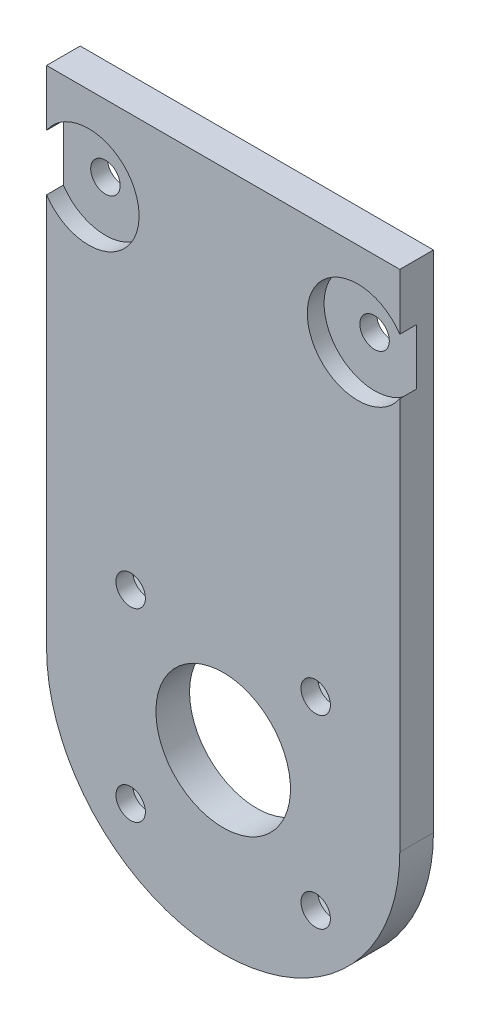
from build123d import *

# Parameters (mm, degrees)
BOSS_EXTRUDE1_DEPTH = 4
SKETCH2_R           = 6
CUT_EXTRUDE1_DEPTH  = 64.694583757
SKETCH3_R           = 8
CUT_EXTRUDE2_DEPTH  = 4
SKETCH4_R           = 1.75
CUT_EXTRUDE3_DEPTH  = 64.694583757
CUT_EXTRUDE4_DEPTH  = 2
SKETCH6_R           = 1.75
CUT_EXTRUDE5_DEPTH  = 64.694583757
SKETCH7_R           = 6
CUT_EXTRUDE6_DEPTH  = 2


with BuildPart() as part:
    # Sketch1 → Boss-Extrude1 (new body)
    with BuildSketch(Plane.XY):
        with BuildLine():
            Line((-21, 0), (-21, 60))
            Line((-21, 60), (21, 60))
            Line((21, 60), (21, 0))
            ThreePointArc((21, 0), (0, -21), (-21, 0))
        make_face()
    extrude(amount=BOSS_EXTRUDE1_DEPTH)

    # Sketch2 → Cut-Extrude1 (cut, through all)
    with BuildSketch(Plane(origin=(0, 0, 0), x_dir=(-1, 0, 0), z_dir=(0, 0, -1))):
        Circle(SKETCH2_R)
    extrude(amount=-CUT_EXTRUDE1_DEPTH, mode=Mode.SUBTRACT)

    # Sketch3 → Cut-Extrude2 (cut)
    with BuildSketch(Plane(origin=(0, 0, 0), x_dir=(-1, 0, 0), z_dir=(0, 0, -1))):
        Circle(SKETCH3_R)
    extrude(amount=-CUT_EXTRUDE2_DEPTH, mode=Mode.SUBTRACT)

    # Sketch4 → Cut-Extrude3 (cut, through all)
    with BuildSketch(Plane(origin=(0, 0, 0), x_dir=(-1, 0, 0), z_dir=(0, 0, -1))):
        with Locations((-11, -11)):
            Circle(SKETCH4_R)
        with Locations(Location((-11, 11, 0), (0, 0, 180))):
            Circle(SKETCH4_R)
        with Locations((11, 11)):
            Circle(SKETCH4_R)
        with Locations(Location((11, -11, 0), (0, 0, 180))):
            Circle(SKETCH4_R)
    extrude(amount=-CUT_EXTRUDE3_DEPTH, mode=Mode.SUBTRACT)

    # Sketch5 → Cut-Extrude4 (cut)
    with BuildSketch(Plane(origin=(0, 0, 0), x_dir=(-1, 0, 0), z_dir=(0, 0, -1))):
        Polygon((-11, -7.709103466), (-13.85, -9.354551733), (-13.85, -12.645448267), (-11, -14.290896534), (-8.15, -12.645448267), (-8.15, -9.354551733), align=None)
        Polygon((-8.15, 9.354551733), (-11, 7.709103466), (-13.85, 9.354551733), (-13.85, 12.645448267), (-11, 14.290896534), (-8.15, 12.645448267), align=None)
        Polygon((11, 7.709103466), (13.85, 9.354551733), (13.85, 12.645448267), (11, 14.290896534), (8.15, 12.645448267), (8.15, 9.354551733), align=None)
        Polygon((8.15, -9.354551733), (11, -7.709103466), (13.85, -9.354551733), (13.85, -12.645448267), (11, -14.290896534), (8.15, -12.645448267), align=None)
    extrude(amount=-CUT_EXTRUDE4_DEPTH, mode=Mode.SUBTRACT)

    # Sketch6 → Cut-Extrude5 (cut, through all)
    with BuildSketch(Plane(origin=(0, 0, 0), x_dir=(-1, 0, 0), z_dir=(0, 0, -1))):
        with Locations((-16, 50)):
            Circle(SKETCH6_R)
        with Locations(Location((16, 50, 0), (0, 0, 180))):
            Circle(SKETCH6_R)
    extrude(amount=-CUT_EXTRUDE5_DEPTH, mode=Mode.SUBTRACT)

    # Sketch7 → Cut-Extrude6 (cut)
    with BuildSketch(Plane.XY.offset(4)):
        with Locations((-16, 50)):
            Circle(SKETCH7_R)
        with Locations((16, 50)):
            Circle(SKETCH7_R)
    extrude(amount=-CUT_EXTRUDE6_DEPTH, mode=Mode.SUBTRACT)


solid = part.part
